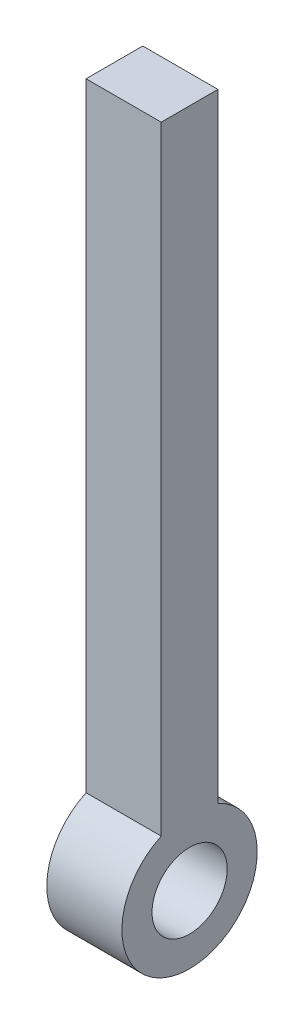
from build123d import *

# Parameters (mm, degrees)
SKETCH_1_R      = 25
EXTRUDE_1_DEPTH = 50


with BuildPart() as part:
    # 草图1 → 凸台-拉伸1 (new body)
    with BuildSketch(Plane(origin=(0, 0, 0), x_dir=(0, 0, -1), z_dir=(1, 0, 0))):
        with BuildLine():
            Line((-18.866454018, 40.854092975), (-18.866454018, 452.179666398))
            Line((-18.866454018, 452.179666398), (18.866454018, 452.179666398))
            Line((18.866454018, 452.179666398), (18.866454018, 40.854092975))
            ThreePointArc((18.866454018, 40.854092975), (0, -45), (-18.866454018, 40.854092975))
        make_face()
        Circle(SKETCH_1_R, mode=Mode.SUBTRACT)
    extrude(amount=EXTRUDE_1_DEPTH)


solid = part.part
